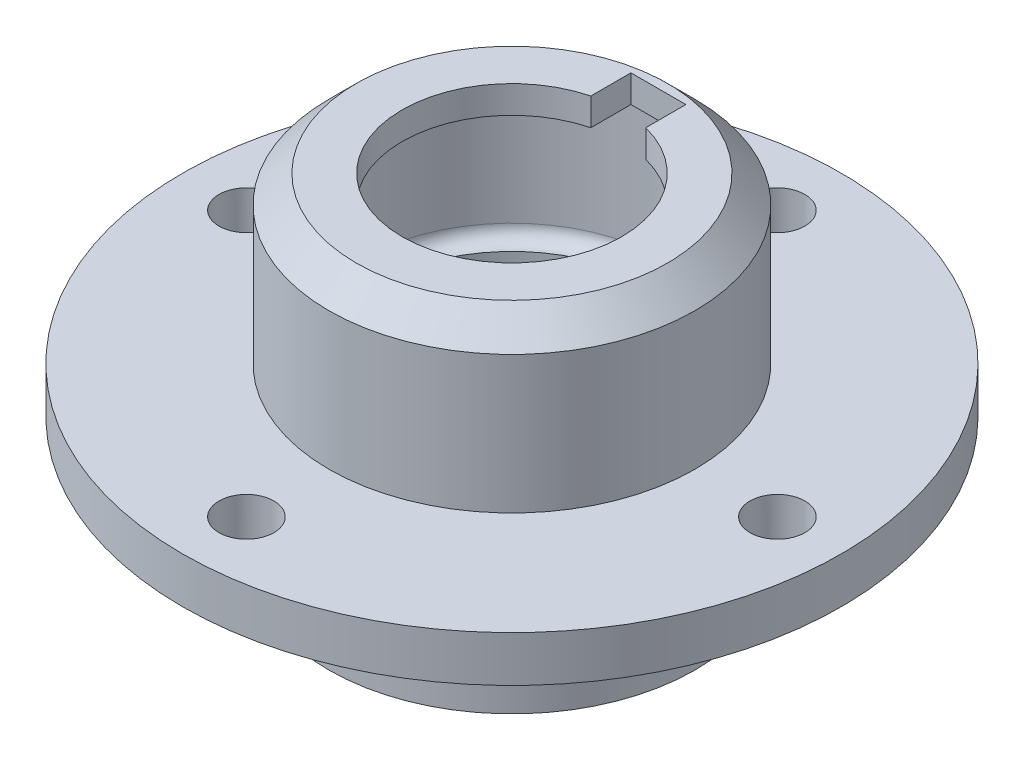
from build123d import *

# Parameters (mm, degrees)
CUT_EXTRUDE1_DEPTH      = 129.265349959
CUT_EXTRUDE1_DEPTH_BACK = 129.265349959
CUT_EXTRUDE2_DEPTH      = 129.265350019
CUT_EXTRUDE2_DEPTH_BACK = 129.265350019
SKETCH3_R               = 6


with BuildPart() as part:
    # Sketch1 → Revolve2 (revolve)
    with BuildSketch(Plane.XY, mode=Mode.PRIVATE) as revolve2_sk:
        with BuildLine():
            Line((30, 0), (40, 4))
            Line((40, 4), (40, 32))
            Line((40, 32), (72, 32))
            Line((72, 32), (72, 42))
            Line((72, 42), (40, 42))
            Line((40, 42), (40, 72))
            Line((40, 72), (34, 78))
            Line((34, 78), (0, 78))
            Line((0, 78), (0, 72))
            Line((0, 72), (33.350051409, 72))
            Line((33.350051409, 72), (33.350051409, 44.979507344))
            ThreePointArc((33.350051409, 44.979507344), (32.343772274, 42.737838966), (30, 42))
            Line((30, 42), (30, 0))
        make_face()
    revolve(revolve2_sk.sketch.rotate(Axis((0, 106.766899484, 0), (0, -1, 0)), 90), axis=Axis((0, 106.766899484, 0), (0, -1, 0)))

    # Sketch2 → Cut-Extrude1 (cut, two sides: drawn at the far end of the back side and taken through both)
    with BuildSketch(Plane(origin=(0, 78, 0), x_dir=(1, 0, 0), z_dir=(0, 1, 0)).offset(-CUT_EXTRUDE1_DEPTH_BACK)):
        with BuildLine():
            Line((-6, 23.237900077), (-6, 32))
            Line((-6, 32), (6, 32))
            Line((6, 32), (6, 23.237900077))
            ThreePointArc((6, 23.237900077), (0, -24), (-6, 23.237900077))
        make_face()
    extrude(amount=CUT_EXTRUDE1_DEPTH + CUT_EXTRUDE1_DEPTH_BACK, mode=Mode.SUBTRACT)

    # Sketch3 → Cut-Extrude2 (cut, two sides: drawn at the far end of the back side and taken through both)
    with BuildSketch(Plane(origin=(0, 78, 0), x_dir=(1, 0, 0), z_dir=(0, 1, 0)).offset(-CUT_EXTRUDE2_DEPTH_BACK)):
        with Locations(Location((0, 58, 0), (0, 0, 270))):
            Circle(SKETCH3_R)
        with Locations(Location((58, 0, 0), (0, 0, 270))):
            Circle(SKETCH3_R)
        with Locations(Location((0, -58, 0), (0, 0, 270))):
            Circle(SKETCH3_R)
        with Locations(Location((-58, 0, 0), (0, 0, 270))):
            Circle(SKETCH3_R)
    extrude(amount=CUT_EXTRUDE2_DEPTH + CUT_EXTRUDE2_DEPTH_BACK, mode=Mode.SUBTRACT)


solid = part.part
